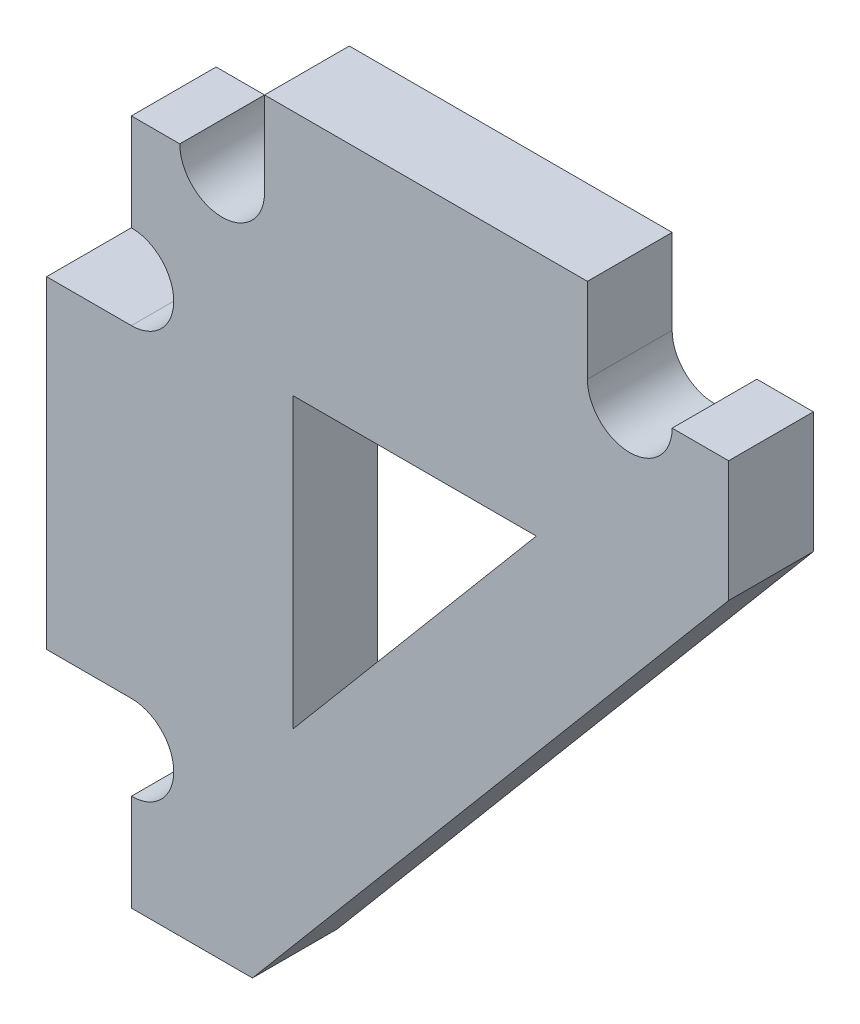
from build123d import *

# Parameters (mm, degrees)
EXTRUDE_1_DEPTH = 2.1


with BuildPart() as part:
    # 草图1 → 凸台-拉伸1 (new body)
    with BuildSketch(Plane.XY):
        with BuildLine():
            Line((1.2, 0), (0, 0))
            Line((0, 0), (0, -2.4))
            ThreePointArc((0, -2.4), (0.74246212, -2.70753788), (1.05, -3.45))
            ThreePointArc((1.05, -3.45), (0.74246212, -4.19246212), (0, -4.5))
            Line((0, -4.5), (-2.1, -4.5))
            Line((-2.1, -4.5), (-2.1, -12.5))
            Line((-2.1, -12.5), (0, -12.5))
            ThreePointArc((0, -12.5), (0.74246212, -12.80753788), (1.05, -13.55))
            ThreePointArc((1.05, -13.55), (0.74246212, -14.29246212), (0, -14.6))
            Line((0, -14.6), (0, -17))
            Line((0, -17), (3, -17))
            Line((3, -17), (14.8, -3))
            Line((14.8, -3), (14.8, 0))
            Line((14.8, 0), (13.4, 0))
            ThreePointArc((13.4, 0), (12.35, -1.05), (11.3, 0))
            Line((11.3, 0), (11.3, 2.1))
            Line((11.3, 2.1), (3.3, 2.1))
            Line((3.3, 2.1), (3.3, 0))
            ThreePointArc((3.3, 0), (2.25, -1.05), (1.2, 0))
        make_face()
        Polygon((4, -11.158586353), (4, -4), (10.033665641, -4), align=None, mode=Mode.SUBTRACT)
    extrude(amount=EXTRUDE_1_DEPTH)


solid = part.part
